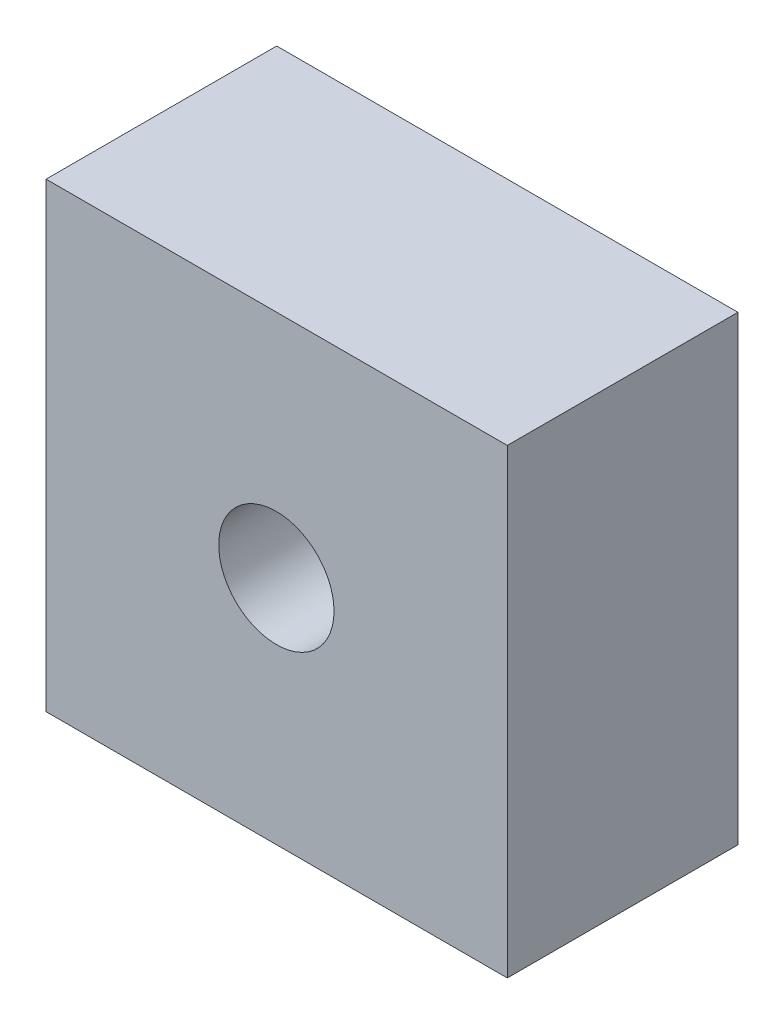
from build123d import *

# Parameters (mm, degrees)
SKETCH_1_W          = 20
SKETCH_1_H          = 20
BASEBOX_DEPTH       = 10
HOLE_WIZARD_1_D     = 5
HOLE_WIZARD_1_DEPTH = 15


with BuildPart() as part:
    # 草图1 → BaseBox (new body)
    with BuildSketch(Plane.XY):
        with Locations((10, 10)):
            Rectangle(SKETCH_1_W, SKETCH_1_H)
    extrude(amount=BASEBOX_DEPTH)

    # 孔1
    with Locations(Plane.XY.offset(10)):
        with Locations((9.986487375, 10.014305599)):
            Hole(HOLE_WIZARD_1_D / 2, depth=HOLE_WIZARD_1_DEPTH)


solid = part.part
